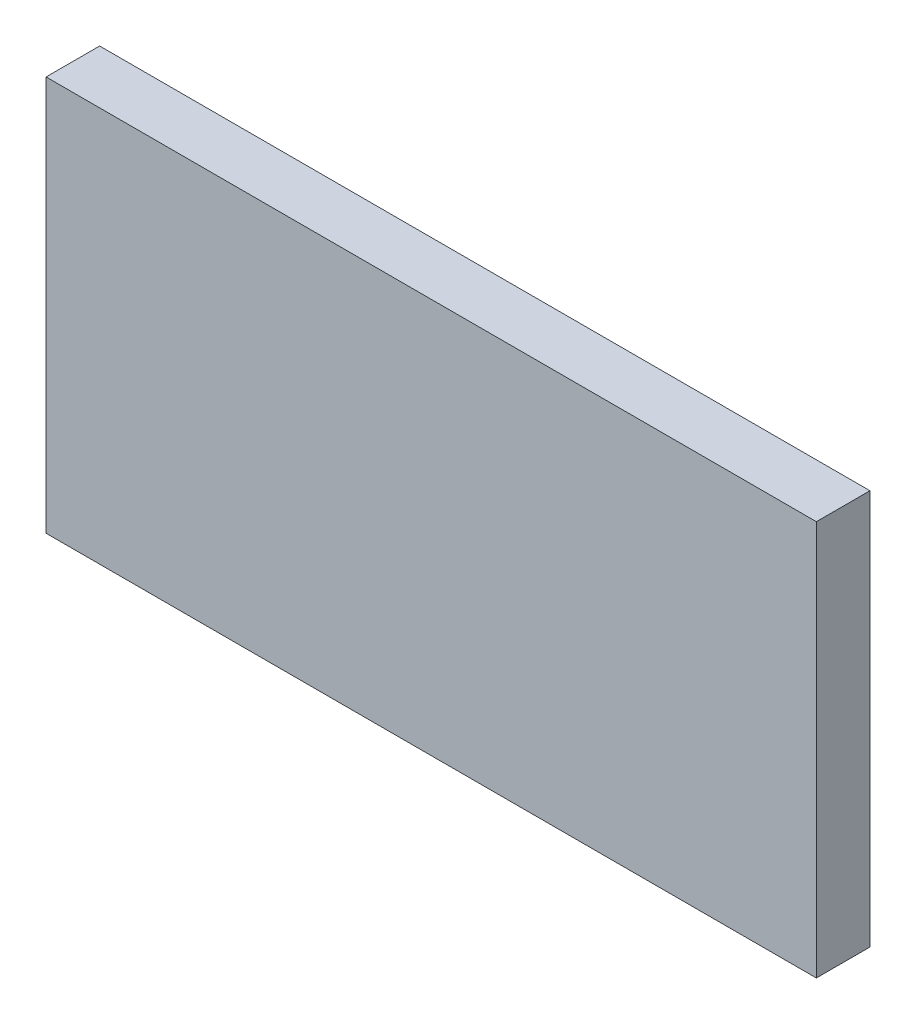
from build123d import *

# Parameters (mm, degrees)
SKETCH_1_W      = 230
SKETCH_1_H      = 118
EXTRUDE_1_DEPTH = 16


with BuildPart() as part:
    # 草图1 → 凸台-拉伸1 (new body)
    with BuildSketch(Plane.XY):
        Rectangle(SKETCH_1_W, SKETCH_1_H)
    extrude(amount=EXTRUDE_1_DEPTH)


solid = part.part
